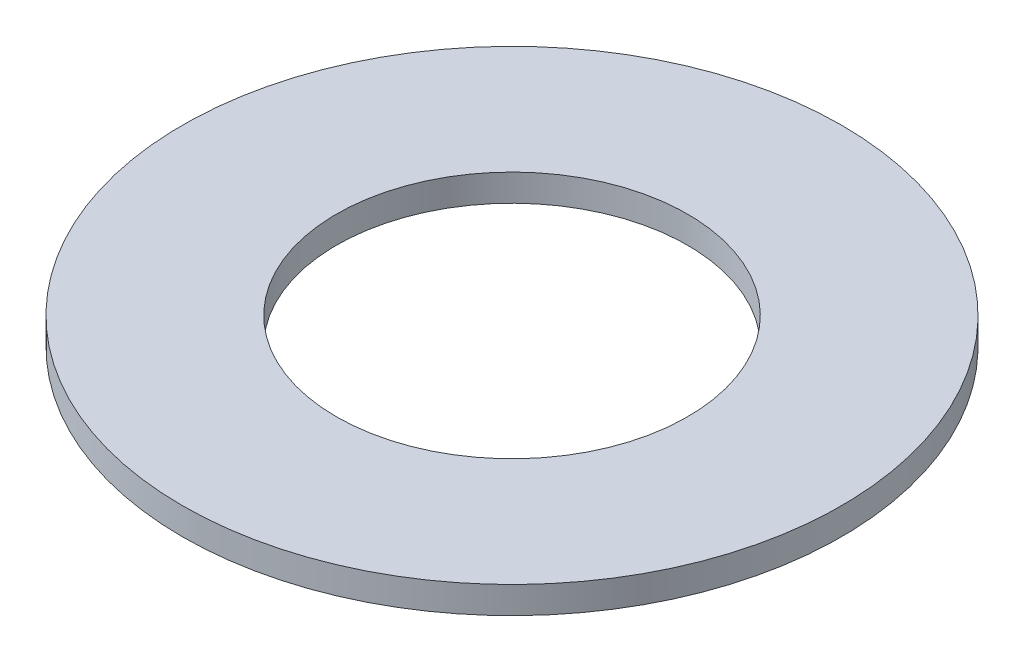
from build123d import *

# Parameters (mm, degrees)
SKETCH1_R           = 7.9375
SKETCH1_R_2         = 4.229
BOSS_EXTRUDE1_DEPTH = 0.65


with BuildPart() as part:
    # Sketch1 → Boss-Extrude1 (new body)
    with BuildSketch(Plane(origin=(0, 0, 0), x_dir=(1, 0, 0), z_dir=(0, 1, 0))):
        with Locations(Location((0, 0, 0), (0, 0, 270))):
            Circle(SKETCH1_R)
        with Locations(Location((0, 0, 0), (0, 0, 270))):
            Circle(SKETCH1_R_2, mode=Mode.SUBTRACT)
    extrude(amount=BOSS_EXTRUDE1_DEPTH)


solid = part.part
